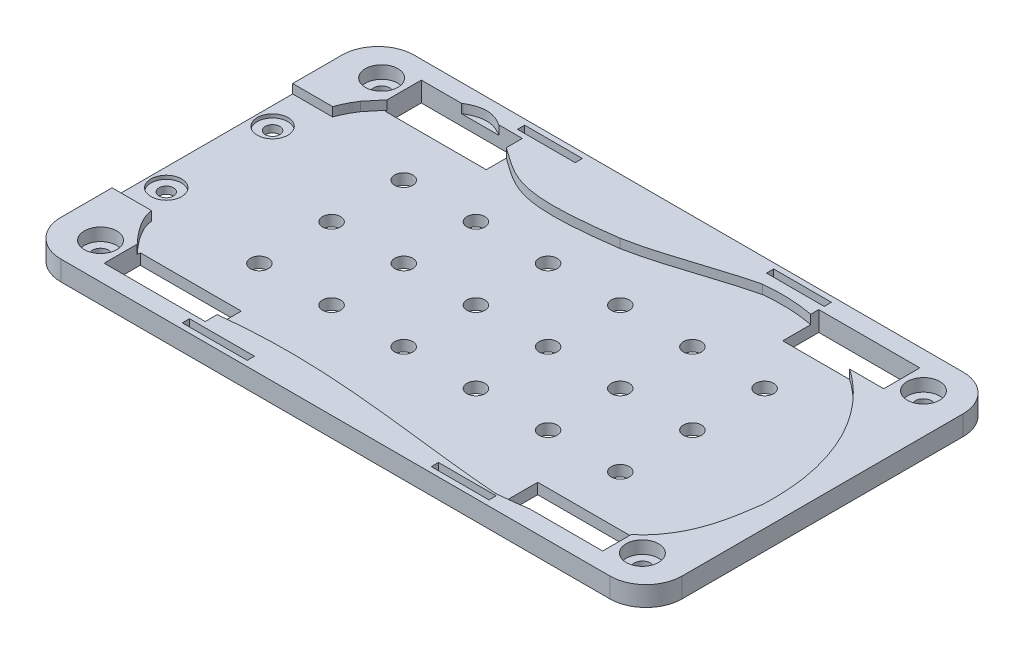
from build123d import *

# Parameters (mm, degrees)
BOSS_EXTRUDE2_DEPTH        = 6.5
CUT_EXTRUDE1_DEPTH         = 2.5
SKETCH7_W                  = 15.126318285
SKETCH7_H                  = 50.045217971
CUT_EXTRUDE2_DEPTH         = 2.5
SKETCH9_R                  = 4.5
CUT_EXTRUDE5_DEPTH         = 3.5
SKETCH10_R                 = 2.25
CUT_EXTRUDE6_DEPTH         = 21
SKETCH8_W                  = 28
SKETCH8_H                  = 10
CUT_EXTRUDE8_DEPTH         = 42
SKETCH8_3_W                = 12
SKETCH8_3_H                = 10
SKETCH8_3_R                = 3.5
CUT_EXTRUDE9_DEPTH         = 1
MIRROR2_COPY_1_SKETCH_R    = 4.5
MIRROR2_COPY_1_DEPTH       = 3.5
MIRROR2_COPY_2_SKETCH_R    = 2.25
MIRROR2_COPY_2_DEPTH       = 21
MIRROR2_COPY_3_SKETCH_W    = 28
MIRROR2_COPY_3_SKETCH_H    = 10
MIRROR2_COPY_3_DEPTH       = 42
MIRROR2_COPY_4_SKETCH_W    = 12
MIRROR2_COPY_4_SKETCH_H    = 10
MIRROR2_COPY_4_SKETCH_R    = 3.5
MIRROR2_COPY_4_DEPTH       = 1
SKETCH13_W                 = 122.138782423
SKETCH13_H                 = 57.881417702
CUT_EXTRUDE10_DEPTH        = 1
SKETCH14_R                 = 2.5
CUT_EXTRUDE11_DEPTH        = 57
SKETCH16_W                 = 16
SKETCH16_H                 = 2
SKETCH16_W_2               = 18
CUT_EXTRUDE12_DEPTH        = 57
SKETCH17_W                 = 198.020150231
SKETCH17_H                 = 122.239022266
CUT_EXTRUDE14_DEPTH        = 48.5
SKETCH23_R                 = 2
CUT_EXTRUDE15_DEPTH        = 48.5
SKETCH23_3_R               = 4.25
SKETCH23_3_R_2             = 2
CUT_EXTRUDE16_DEPTH        = 1
SKETCH24_R                 = 3.25
SKETCH24_R_2               = 2.25
BOSS_EXTRUDE3_DEPTH        = 1
MIRROR5_COPY_1_SKETCH_R    = 4.5
MIRROR5_COPY_1_DEPTH       = 3.5
MIRROR5_COPY_2_SKETCH_R    = 2.25
MIRROR5_COPY_2_DEPTH       = 21
MIRROR5_COPY_3_SKETCH_W    = 28
MIRROR5_COPY_3_SKETCH_H    = 10
MIRROR5_COPY_3_DEPTH       = 42
MIRROR5_COPY_4_SKETCH_W    = 12
MIRROR5_COPY_4_SKETCH_H    = 10
MIRROR5_COPY_4_SKETCH_R    = 3.5
MIRROR5_COPY_4_DEPTH       = 1
MIRROR5_COPY_5_SKETCH_R    = 4.5
MIRROR5_COPY_5_DEPTH       = 3.5
MIRROR5_COPY_6_SKETCH_R    = 2.25
MIRROR5_COPY_6_DEPTH       = 21
MIRROR5_COPY_7_SKETCH_W    = 28
MIRROR5_COPY_7_SKETCH_H    = 10
MIRROR5_COPY_7_DEPTH       = 42
MIRROR5_COPY_8_SKETCH_W    = 12
MIRROR5_COPY_8_SKETCH_H    = 10
MIRROR5_COPY_8_SKETCH_R    = 3.5
MIRROR5_COPY_8_DEPTH       = 1
MIRROR5_COPY_9_SKETCH_R    = 4.5
MIRROR5_COPY_9_DEPTH       = 3.5
MIRROR5_COPY_10_SKETCH_R   = 2.25
MIRROR5_COPY_10_DEPTH      = 21
MIRROR5_COPY_11_SKETCH_W   = 28
MIRROR5_COPY_11_SKETCH_H   = 10
MIRROR5_COPY_11_DEPTH      = 42
MIRROR5_COPY_12_SKETCH_W   = 12
MIRROR5_COPY_12_SKETCH_H   = 10
MIRROR5_COPY_12_SKETCH_R   = 3.5
MIRROR5_COPY_12_DEPTH      = 1
MIRROR5_COPY_13_SKETCH_R   = 2
MIRROR5_COPY_13_DEPTH      = 48.5
MIRROR5_COPY_14_SKETCH_R   = 4.25
MIRROR5_COPY_14_SKETCH_R_2 = 2
MIRROR5_COPY_14_DEPTH      = 1
CUT_EXTRUDE18_START        = -5.5
SKETCH25_W                 = 220.332555495
SKETCH25_H                 = 149.430085415
CUT_EXTRUDE18_DEPTH        = 6.5


with BuildPart() as part:
    # Sketch6 → Boss-Extrude2 (new body)
    with BuildSketch(Plane(origin=(0, 0, 0), x_dir=(1, 0, 0), z_dir=(0, 1, 0))):
        with BuildLine():
            Line((73.981646775, 59.583909473), (-78.157135648, 59.583909473))
            ThreePointArc((-78.157135648, 59.583909473), (-85.22820346, 56.654977285), (-88.157135648, 49.583909473))
            Line((-88.157135648, 49.583909473), (-88.157135648, -28.297508229))
            ThreePointArc((-88.157135648, -28.297508229), (-85.22820346, -35.368576041), (-78.157135648, -38.297508229))
            Line((-78.157135648, -38.297508229), (73.981646775, -38.297508229))
            ThreePointArc((73.981646775, -38.297508229), (81.052714587, -35.368576041), (83.981646775, -28.297508229))
            Line((83.981646775, -28.297508229), (83.981646775, 49.583909473))
            ThreePointArc((83.981646775, 49.583909473), (81.052714587, 56.654977285), (73.981646775, 59.583909473))
        make_face()
    boss_extrude2 = extrude(amount=BOSS_EXTRUDE2_DEPTH)

    # Sketch1 → Cut-Extrude1 (cut)
    with BuildSketch(Plane(origin=(0, 0, 0), x_dir=(1, 0, 0), z_dir=(0, 1, 0))):
        with BuildLine():
            Line((77.806365081, -0.96565382), (-77.157134057, -0.96565382))
            Line((-77.157134057, -0.96565382), (-77.157133487, -14.112200011))
            add(Edge.make_bspline(
                [(-77.157133487, -14.112200011), (-77.156536942, -14.370123486), (-77.109197781, -14.873209632), (-76.835922488, -15.955912897), (-76.187889009, -17.500769448), (-75.043983016, -19.418277882), (-73.152039277, -22.009216703), (-70.349522729, -25.082160357), (-66.873619377, -28.097169115), (-63.686430755, -30.214139025), (-61.001852204, -31.406236435), (-58.827378352, -31.848010778), (-57.571800044, -31.879365283), (-56.919048161, -31.916770504)],
                knots=[0.000484301, 0.000484301, 0.000484301, 0.000484301, 0.031521334, 0.062558366, 0.124632431, 0.186706496, 0.248780561, 0.37292869, 0.49707682, 0.62122495, 0.745373079, 0.869521209, 0.993669339, 0.993669339, 0.993669339, 0.993669339], degree=3))
            add(Edge.make_bspline(
                [(-56.919048161, -31.916770504), (-56.676855651, -31.887329504), (-56.202107187, -31.827411173), (-55.17909933, -31.687000892), (-53.829380758, -31.487736495), (-52.075898695, -31.218386946), (-49.57440565, -30.835368063), (-46.14645809, -30.337211074), (-41.582465958, -29.781294531), (-36.59758114, -29.326101352), (-29.427370913, -28.913030471), (-19.557102597, -28.846779859), (-6.483877393, -29.587535165), (5.244808229, -30.786505775), (15.023020088, -31.929485511), (22.521025078, -32.809036887), (30.153844065, -33.641998773), (35.340846207, -34.107490241), (37.926285135, -34.298975741)],
                knots=[0.000538145, 0.000538145, 0.000538145, 0.000538145, 0.016151963, 0.031765781, 0.062993416, 0.094221052, 0.125448688, 0.18790396, 0.250359232, 0.312814503, 0.375269775, 0.500180319, 0.625090862, 0.750001406, 0.812456678, 0.874911949, 0.937367221, 0.999822493, 0.999822493, 0.999822493, 0.999822493], degree=3))
            ThreePointArc((37.926285135, -34.298975741), (38.702526051, -34.294429262), (39.475271872, -34.220710033))
            add(Edge.make_bspline(
                [(39.475271872, -34.220710033), (41.007855914, -34.057436076), (44.089984585, -33.714701696), (50.083540013, -32.842915348), (57.096899249, -31.185924421), (64.218389099, -27.883874428), (69.776327895, -23.185685517), (73.049743993, -18.278857828), (74.917700916, -14.026885359), (75.980532113, -10.773207259), (76.750872111, -7.572378035), (77.199527425, -5.064024493), (77.479780782, -3.227934), (77.653952405, -2.012317888), (77.758523252, -1.282417326), (77.806365081, -0.96565382)],
                knots=[-0.000308659, -0.000308659, -0.000308659, -0.000308659, 0.063093373, 0.126495404, 0.253299468, 0.380103532, 0.506907596, 0.633711659, 0.697113691, 0.760515723, 0.823917755, 0.887319787, 0.919020803, 0.950721818, 0.978851886, 0.978851886, 0.978851886, 0.978851886], degree=3))
        make_face()
        with BuildLine():
            Line((-77.157135648, 35.76464303), (-77.157134057, -0.96565382))
            Line((-77.157134057, -0.96565382), (77.806365081, -0.96565382))
            add(Edge.make_bspline(
                [(77.806365081, -0.96565382), (77.812438323, -0.925442533), (77.87221605, -0.53245946), (77.930059012, -0.183407073), (77.984899751, 0.147711222)],
                knots=[0.978851886, 0.978851886, 0.978851886, 0.978851886, 0.982422834, 1.01412385, 1.01412385, 1.01412385, 1.01412385], degree=3))
            add(Edge.make_bspline(
                [(77.984899751, 0.147711222), (78.028632075, 1.263321996), (78.063685274, 3.522430751), (77.942610131, 6.756968322), (77.659550444, 9.90467033), (77.073307047, 13.967118446), (75.962568899, 18.783585703), (73.443316656, 25.935742417), (69.020568834, 33.80984715), (62.049489108, 41.493231365), (53.789484117, 47.344418041), (44.612113932, 51.294661515), (34.903628635, 53.280392725), (28.311253849, 53.235690332), (25.060177828, 52.873239487)],
                knots=[0.000169226, 0.000169226, 0.000169226, 0.000169226, 0.031413574, 0.062657922, 0.09390227, 0.125146618, 0.187635314, 0.25012401, 0.375101401, 0.500078793, 0.625056185, 0.750033577, 0.875010969, 0.999988361, 0.999988361, 0.999988361, 0.999988361], degree=3))
            add(Edge.make_bspline(
                [(25.060177828, 52.873239487), (19.895446944, 51.629390577), (12.322434608, 49.13169364), (2.160698602, 45.971278142), (-3.037110446, 44.691336857), (-5.659268145, 44.190364293)],
                knots=[0.000658959, 0.000658959, 0.000658959, 0.000658959, 0.498067368, 0.746771573, 0.995475778, 0.995475778, 0.995475778, 0.995475778], degree=3))
            add(Edge.make_bspline(
                [(-5.659268145, 44.190364293), (-6.687899132, 44.046149587), (-8.728734339, 43.771857825), (-12.963271971, 43.266800577), (-18.182613839, 42.795189919), (-23.901458121, 42.63215561), (-28.830638135, 42.989857068), (-32.966568973, 43.951399156), (-35.917714049, 45.291439085), (-38.19591431, 46.677930402), (-39.939161114, 47.865789175), (-41.506959745, 48.979842665), (-42.863802202, 49.929184347), (-43.616290768, 50.440510486), (-43.98532936, 50.688555671)],
                knots=[-0.00019559, -0.00019559, -0.00019559, -0.00019559, 0.062587211, 0.125370012, 0.250935613, 0.376501215, 0.502066816, 0.627632417, 0.753198019, 0.81598082, 0.87876362, 0.941546421, 0.972937821, 1.004329222, 1.004329222, 1.004329222, 1.004329222], degree=3))
            add(Edge.make_bspline(
                [(-43.98532936, 50.688555671), (-44.244485854, 50.867312015), (-44.768150418, 51.232519494), (-45.750657054, 51.933111662), (-46.891239492, 52.75905139), (-48.145972585, 53.649626958), (-49.697116091, 54.681113287), (-51.460780236, 55.648746777), (-53.407719169, 56.259273829), (-55.251731489, 56.357375065), (-56.710973324, 56.08081223), (-57.794758617, 55.713765742), (-58.546542767, 55.391458897), (-59.229896481, 55.042763399), (-59.583745645, 54.835934013), (-59.770155285, 54.723823826)],
                knots=[-0.002497219, -0.002497219, -0.002497219, -0.002497219, 0.029065652, 0.060628523, 0.123754265, 0.186880007, 0.250005749, 0.376257234, 0.502508718, 0.628760202, 0.755011687, 0.818137429, 0.881263171, 0.944388913, 1.007514655, 1.007514655, 1.007514655, 1.007514655], degree=3))
            add(Edge.make_bspline(
                [(-59.770155285, 54.723823826), (-60.193626174, 54.476092852), (-61.03864602, 53.961192652), (-62.636768194, 52.907176262), (-65.258656407, 50.976312285), (-68.51709364, 48.049765778), (-71.244275363, 45.065662035), (-73.189921829, 42.724657875), (-74.069794154, 41.617885903), (-74.515784144, 41.052117052)],
                knots=[0.000174078, 0.000174078, 0.000174078, 0.000174078, 0.062881444, 0.12558881, 0.251003541, 0.501833004, 0.752662466, 0.878077198, 1.003491929, 1.003491929, 1.003491929, 1.003491929], degree=3))
            add(Edge.make_bspline(
                [(-74.515784144, 41.052117052), (-75.065753244, 40.22169422), (-76.07645723, 38.477870595), (-76.833603448, 36.687528936), (-77.157135648, 35.76464303)],
                knots=[0.499549048, 0.499549048, 0.499549048, 0.499549048, 0.499765799, 0.49998255, 0.49998255, 0.49998255, 0.49998255], degree=3))
        make_face()
    cut_extrude1 = extrude(amount=CUT_EXTRUDE1_DEPTH, mode=Mode.SUBTRACT)

    # Sketch7 → Cut-Extrude2 (cut)
    with BuildSketch(Plane.XZ):
        with Locations((-83.782077592, -10.91040897)):
            Rectangle(SKETCH7_W, SKETCH7_H)
    cut_extrude2 = extrude(amount=-CUT_EXTRUDE2_DEPTH, mode=Mode.SUBTRACT)

    # Sketch9 → Cut-Extrude5 (cut)
    with BuildSketch(Plane.XZ):
        with Locations(Location((72.981646775, -49.583909473, 0), (0, 0, 270))):
            Circle(SKETCH9_R)
    cut_extrude5 = extrude(amount=-CUT_EXTRUDE5_DEPTH, mode=Mode.SUBTRACT)

    # Sketch10 → Cut-Extrude6 (cut)
    with BuildSketch(Plane.XZ.offset(-3.5)):
        with Locations(Location((72.981646775, -49.583909473, 0), (0, 0, 270))):
            Circle(SKETCH10_R)
    cut_extrude6 = extrude(amount=-CUT_EXTRUDE6_DEPTH, mode=Mode.SUBTRACT)

    # Sketch8 → Cut-Extrude8 (cut)
    with BuildSketch(Plane(origin=(0, 6.5, 0), x_dir=(1, 0, 0), z_dir=(0, 1, 0))):
        with Locations((52.981646775, 49.583909473)):
            Rectangle(SKETCH8_W, SKETCH8_H)
    cut_extrude8 = extrude(amount=-CUT_EXTRUDE8_DEPTH, mode=Mode.SUBTRACT)

    # Sketch8<3> → Cut-Extrude9 (cut)
    with BuildSketch(Plane(origin=(0, 6.5, 0), x_dir=(1, 0, 0), z_dir=(0, 1, 0))):
        with Locations((72.981646775, 49.583909473)):
            Rectangle(SKETCH8_3_W, SKETCH8_3_H)
        with Locations(Location((72.981646775, 49.583909473, 0), (0, 0, 270))):
            Circle(SKETCH8_3_R, mode=Mode.SUBTRACT)
    cut_extrude9 = extrude(amount=-CUT_EXTRUDE9_DEPTH, mode=Mode.SUBTRACT)

    # Mirror1: Cut-Extrude5, Cut-Extrude6, Cut-Extrude8, Cut-Extrude9 across plane
    add(cut_extrude5.mirror(Plane.XY.offset(-10.643200622)), mode=Mode.SUBTRACT)
    add(cut_extrude6.mirror(Plane.XY.offset(-10.643200622)), mode=Mode.SUBTRACT)
    add(cut_extrude8.mirror(Plane.XY.offset(-10.643200622)), mode=Mode.SUBTRACT)
    add(cut_extrude9.mirror(Plane.XY.offset(-10.643200622)), mode=Mode.SUBTRACT)

    # Mirror2: Cut-Extrude5, Cut-Extrude6, Cut-Extrude8, Cut-Extrude9 across plane
    add(cut_extrude5.mirror(Plane.ZY.offset(2.087744437)), mode=Mode.SUBTRACT)
    add(cut_extrude6.mirror(Plane.ZY.offset(2.087744437)), mode=Mode.SUBTRACT)
    add(cut_extrude8.mirror(Plane.ZY.offset(2.087744437)), mode=Mode.SUBTRACT)
    add(cut_extrude9.mirror(Plane.ZY.offset(2.087744437)), mode=Mode.SUBTRACT)

    # Mirror2 copy 1 sketch → Mirror2 copy 1 (cut)
    with BuildSketch(Plane(origin=(-4.175488873, 0, -21.286401244), x_dir=(-1, 0, 0), z_dir=(0, -1, 0))):
        with Locations(Location((72.981646775, -49.583909473, 0), (0, 0, 270))):
            Circle(MIRROR2_COPY_1_SKETCH_R)
    extrude(amount=-MIRROR2_COPY_1_DEPTH, mode=Mode.SUBTRACT)

    # Mirror2 copy 2 sketch → Mirror2 copy 2 (cut)
    with BuildSketch(Plane(origin=(-4.175488873, 3.5, -21.286401244), x_dir=(-1, 0, 0), z_dir=(0, -1, 0))):
        with Locations(Location((72.981646775, -49.583909473, 0), (0, 0, 270))):
            Circle(MIRROR2_COPY_2_SKETCH_R)
    extrude(amount=-MIRROR2_COPY_2_DEPTH, mode=Mode.SUBTRACT)

    # Mirror2 copy 3 sketch → Mirror2 copy 3 (cut)
    with BuildSketch(Plane(origin=(-4.175488873, 6.5, -21.286401244), x_dir=(-1, 0, 0), z_dir=(0, 1, 0))):
        with Locations((52.981646775, 49.583909473)):
            Rectangle(MIRROR2_COPY_3_SKETCH_W, MIRROR2_COPY_3_SKETCH_H)
    extrude(amount=-MIRROR2_COPY_3_DEPTH, mode=Mode.SUBTRACT)

    # Mirror2 copy 4 sketch → Mirror2 copy 4 (cut)
    with BuildSketch(Plane(origin=(-4.175488873, 6.5, -21.286401244), x_dir=(-1, 0, 0), z_dir=(0, 1, 0))):
        with Locations((72.981646775, 49.583909473)):
            Rectangle(MIRROR2_COPY_4_SKETCH_W, MIRROR2_COPY_4_SKETCH_H)
        with Locations(Location((72.981646775, 49.583909473, 0), (0, 0, 270))):
            Circle(MIRROR2_COPY_4_SKETCH_R, mode=Mode.SUBTRACT)
    extrude(amount=-MIRROR2_COPY_4_DEPTH, mode=Mode.SUBTRACT)

    # Sketch13 → Cut-Extrude10 (cut)
    with BuildSketch(Plane(origin=(0, 6.5, 0), x_dir=(1, 0, 0), z_dir=(0, 1, 0))):
        with Locations((-2.087744436, 10.643200622)):
            Rectangle(SKETCH13_W, SKETCH13_H)
    cut_extrude10 = extrude(amount=-CUT_EXTRUDE10_DEPTH, mode=Mode.SUBTRACT)

    # Sketch14 → Cut-Extrude11 (cut)
    with BuildSketch(Plane(origin=(0, 5.5, 0), x_dir=(1, 0, 0), z_dir=(0, 1, 0))):
        with Locations(Location((-52.087744437, 30.643200622, 0), (0, 0, 270))):
            Circle(SKETCH14_R)
        with Locations(Location((7.912255563, 30.643200622, 0), (0, 0, 270))):
            Circle(SKETCH14_R)
        with Locations(Location((27.912255563, 30.643200622, 0), (0, 0, 270))):
            Circle(SKETCH14_R)
        with Locations(Location((47.912255563, 30.643200622, 0), (0, 0, 270))):
            Circle(SKETCH14_R)
        with Locations(Location((47.912255563, 10.643200622, 0), (0, 0, 270))):
            Circle(SKETCH14_R)
        with Locations(Location((7.912255563, 10.643200622, 0), (0, 0, 270))):
            Circle(SKETCH14_R)
        with Locations(Location((-12.087744437, 10.643200622, 0), (0, 0, 270))):
            Circle(SKETCH14_R)
        with Locations(Location((-32.087744437, 10.643200622, 0), (0, 0, 270))):
            Circle(SKETCH14_R)
        with Locations(Location((-52.087744437, 10.643200622, 0), (0, 0, 270))):
            Circle(SKETCH14_R)
        with Locations(Location((47.912255563, -9.356799378, 0), (0, 0, 270))):
            Circle(SKETCH14_R)
        with Locations(Location((27.912255563, -9.356799378, 0), (0, 0, 270))):
            Circle(SKETCH14_R)
        with Locations(Location((7.912255563, -9.356799378, 0), (0, 0, 270))):
            Circle(SKETCH14_R)
        with Locations(Location((-12.087744437, -9.356799378, 0), (0, 0, 270))):
            Circle(SKETCH14_R)
        with Locations(Location((-32.087744437, -9.356799378, 0), (0, 0, 270))):
            Circle(SKETCH14_R)
        with Locations(Location((-52.087744437, -9.356799378, 0), (0, 0, 270))):
            Circle(SKETCH14_R)
        with Locations(Location((-32.087744437, 30.643200622, 0), (0, 0, 270))):
            Circle(SKETCH14_R)
        with Locations(Location((-12.087744437, 30.643200622, 0), (0, 0, 270))):
            Circle(SKETCH14_R)
        with Locations(Location((27.912255563, 10.643200622, 0), (0, 0, 270))):
            Circle(SKETCH14_R)
    cut_extrude11 = extrude(amount=-CUT_EXTRUDE11_DEPTH, mode=Mode.SUBTRACT)

    # Sketch16 → Cut-Extrude12 (cut)
    with BuildSketch(Plane.XZ):
        with Locations((30.981646775, -57.083909473)):
            Rectangle(SKETCH16_W, SKETCH16_H)
        with Locations((30.981646775, 35.797508229)):
            Rectangle(SKETCH16_W, SKETCH16_H)
        with Locations((-38.018353225, -57.083909473)):
            Rectangle(SKETCH16_W, SKETCH16_H)
        with Locations((-37.018353225, 35.797508229)):
            Rectangle(SKETCH16_W_2, SKETCH16_H)
    cut_extrude12 = extrude(amount=-CUT_EXTRUDE12_DEPTH, mode=Mode.SUBTRACT)

    # Sketch17 → Cut-Extrude14 (cut)
    with BuildSketch(Plane(origin=(0, 5.5, 0), x_dir=(1, 0, 0), z_dir=(0, 1, 0))):
        with Locations((-0.586253557, 7.90518784)):
            Rectangle(SKETCH17_W, SKETCH17_H)
    cut_extrude14 = extrude(amount=CUT_EXTRUDE14_DEPTH, mode=Mode.SUBTRACT)

    # Sketch23 → Cut-Extrude15 (cut)
    with BuildSketch(Plane.XZ.offset(-2.5)):
        with Locations(Location((-83.157135648, 4.08959103, 0), (0, 0, 270))):
            Circle(SKETCH23_R)
    cut_extrude15 = extrude(amount=-CUT_EXTRUDE15_DEPTH, mode=Mode.SUBTRACT)

    # Sketch23<3> → Cut-Extrude16 (cut)
    with BuildSketch(Plane.XZ.offset(-2.5)):
        with Locations(Location((-83.157135648, 4.08959103, 0), (0, 0, 270))):
            Circle(SKETCH23_3_R)
        with Locations(Location((-83.157135648, 4.08959103, 0), (0, 0, 270))):
            Circle(SKETCH23_3_R_2, mode=Mode.SUBTRACT)
    cut_extrude16 = extrude(amount=-CUT_EXTRUDE16_DEPTH, mode=Mode.SUBTRACT)

    # Mirror4: Cut-Extrude15, Cut-Extrude16 across plane
    add(cut_extrude15.mirror(Plane.XY.offset(-10.643200622)), mode=Mode.SUBTRACT)
    add(cut_extrude16.mirror(Plane.XY.offset(-10.643200622)), mode=Mode.SUBTRACT)

    # Sketch24 → Boss-Extrude3 (add)
    # profile 1 of 4: a face of its own
    with BuildSketch(Plane(origin=(0, 5.5, 0), x_dir=(1, 0, 0), z_dir=(0, 1, 0))):
        with Locations(Location((-77.157135648, 49.583909473, 0), (0, 0, 270))):
            Circle(SKETCH24_R)
        with Locations(Location((-77.157135648, 49.583909473, 0), (0, 0, 90))):
            Circle(SKETCH24_R_2, mode=Mode.SUBTRACT)
    # profile 2 of 4: a face of its own
    with BuildSketch(Plane(origin=(0, 5.5, 0), x_dir=(1, 0, 0), z_dir=(0, 1, 0))):
        with Locations(Location((72.981646775, 49.583909473, 0), (0, 0, 270))):
            Circle(SKETCH24_R)
        with Locations(Location((72.981646775, 49.583909473, 0), (0, 0, 90))):
            Circle(SKETCH24_R_2, mode=Mode.SUBTRACT)
    # profile 3 of 4: a face of its own
    with BuildSketch(Plane(origin=(0, 5.5, 0), x_dir=(1, 0, 0), z_dir=(0, 1, 0))):
        with Locations(Location((-77.157135648, -28.297508229, 0), (0, 0, 270))):
            Circle(SKETCH24_R)
        with Locations(Location((-77.157135648, -28.297508229, 0), (0, 0, 270))):
            Circle(SKETCH24_R_2, mode=Mode.SUBTRACT)
    # profile 4 of 4: a face of its own
    with BuildSketch(Plane(origin=(0, 5.5, 0), x_dir=(1, 0, 0), z_dir=(0, 1, 0))):
        with Locations(Location((72.981646775, -28.297508229, 0), (0, 0, 270))):
            Circle(SKETCH24_R)
        with Locations(Location((72.981646775, -28.297508229, 0), (0, 0, 270))):
            Circle(SKETCH24_R_2, mode=Mode.SUBTRACT)
    boss_extrude3 = extrude(amount=BOSS_EXTRUDE3_DEPTH)

    # Mirror5: Boss-Extrude2, Cut-Extrude1, Cut-Extrude2, Cut-Extrude5, Cut-Extrude6, Cut-Extrude8, Cut-Extrude9, Cut-Extrude10, Cut-Extrude11, Cut-Extrude12, Cut-Extrude14, Cut-Extrude15, Cut-Extrude16, Boss-Extrude3 across plane
    add(boss_extrude2.mirror(Plane(origin=(0, 0, 0), x_dir=(0, 0, 1), z_dir=(0, -1, 0))))
    add(cut_extrude1.mirror(Plane(origin=(0, 0, 0), x_dir=(0, 0, 1), z_dir=(0, -1, 0))), mode=Mode.SUBTRACT)
    add(cut_extrude2.mirror(Plane(origin=(0, 0, 0), x_dir=(0, 0, 1), z_dir=(0, -1, 0))), mode=Mode.SUBTRACT)
    add(cut_extrude5.mirror(Plane(origin=(0, 0, 0), x_dir=(0, 0, 1), z_dir=(0, -1, 0))), mode=Mode.SUBTRACT)
    add(cut_extrude6.mirror(Plane(origin=(0, 0, 0), x_dir=(0, 0, 1), z_dir=(0, -1, 0))), mode=Mode.SUBTRACT)
    add(cut_extrude8.mirror(Plane(origin=(0, 0, 0), x_dir=(0, 0, 1), z_dir=(0, -1, 0))), mode=Mode.SUBTRACT)
    add(cut_extrude9.mirror(Plane(origin=(0, 0, 0), x_dir=(0, 0, 1), z_dir=(0, -1, 0))), mode=Mode.SUBTRACT)
    add(cut_extrude10.mirror(Plane(origin=(0, 0, 0), x_dir=(0, 0, 1), z_dir=(0, -1, 0))), mode=Mode.SUBTRACT)
    add(cut_extrude11.mirror(Plane(origin=(0, 0, 0), x_dir=(0, 0, 1), z_dir=(0, -1, 0))), mode=Mode.SUBTRACT)
    add(cut_extrude12.mirror(Plane(origin=(0, 0, 0), x_dir=(0, 0, 1), z_dir=(0, -1, 0))), mode=Mode.SUBTRACT)
    add(cut_extrude14.mirror(Plane(origin=(0, 0, 0), x_dir=(0, 0, 1), z_dir=(0, -1, 0))), mode=Mode.SUBTRACT)
    add(cut_extrude15.mirror(Plane(origin=(0, 0, 0), x_dir=(0, 0, 1), z_dir=(0, -1, 0))), mode=Mode.SUBTRACT)
    add(cut_extrude16.mirror(Plane(origin=(0, 0, 0), x_dir=(0, 0, 1), z_dir=(0, -1, 0))), mode=Mode.SUBTRACT)
    add(boss_extrude3.mirror(Plane(origin=(0, 0, 0), x_dir=(0, 0, 1), z_dir=(0, -1, 0))))

    # Mirror5 copy 1 sketch → Mirror5 copy 1 (cut)
    with BuildSketch(Plane(origin=(0, 0, -21.286401244), x_dir=(1, 0, 0), z_dir=(0, 1, 0))):
        with Locations(Location((72.981646775, -49.583909473, 0), (0, 0, 270))):
            Circle(MIRROR5_COPY_1_SKETCH_R)
    extrude(amount=-MIRROR5_COPY_1_DEPTH, mode=Mode.SUBTRACT)

    # Mirror5 copy 2 sketch → Mirror5 copy 2 (cut)
    with BuildSketch(Plane(origin=(0, -3.5, -21.286401244), x_dir=(1, 0, 0), z_dir=(0, 1, 0))):
        with Locations(Location((72.981646775, -49.583909473, 0), (0, 0, 270))):
            Circle(MIRROR5_COPY_2_SKETCH_R)
    extrude(amount=-MIRROR5_COPY_2_DEPTH, mode=Mode.SUBTRACT)

    # Mirror5 copy 3 sketch → Mirror5 copy 3 (cut)
    with BuildSketch(Plane(origin=(0, -6.5, -21.286401244), x_dir=(1, 0, 0), z_dir=(0, -1, 0))):
        with Locations((52.981646775, 49.583909473)):
            Rectangle(MIRROR5_COPY_3_SKETCH_W, MIRROR5_COPY_3_SKETCH_H)
    extrude(amount=-MIRROR5_COPY_3_DEPTH, mode=Mode.SUBTRACT)

    # Mirror5 copy 4 sketch → Mirror5 copy 4 (cut)
    with BuildSketch(Plane(origin=(0, -6.5, -21.286401244), x_dir=(1, 0, 0), z_dir=(0, -1, 0))):
        with Locations((72.981646775, 49.583909473)):
            Rectangle(MIRROR5_COPY_4_SKETCH_W, MIRROR5_COPY_4_SKETCH_H)
        with Locations(Location((72.981646775, 49.583909473, 0), (0, 0, 270))):
            Circle(MIRROR5_COPY_4_SKETCH_R, mode=Mode.SUBTRACT)
    extrude(amount=-MIRROR5_COPY_4_DEPTH, mode=Mode.SUBTRACT)

    # Mirror5 copy 5 sketch → Mirror5 copy 5 (cut)
    with BuildSketch(Plane(origin=(-4.175488873, 0, 0), x_dir=(-1, 0, 0), z_dir=(0, 1, 0))):
        with Locations(Location((72.981646775, -49.583909473, 0), (0, 0, 270))):
            Circle(MIRROR5_COPY_5_SKETCH_R)
    extrude(amount=-MIRROR5_COPY_5_DEPTH, mode=Mode.SUBTRACT)

    # Mirror5 copy 6 sketch → Mirror5 copy 6 (cut)
    with BuildSketch(Plane(origin=(-4.175488873, -3.5, 0), x_dir=(-1, 0, 0), z_dir=(0, 1, 0))):
        with Locations(Location((72.981646775, -49.583909473, 0), (0, 0, 270))):
            Circle(MIRROR5_COPY_6_SKETCH_R)
    extrude(amount=-MIRROR5_COPY_6_DEPTH, mode=Mode.SUBTRACT)

    # Mirror5 copy 7 sketch → Mirror5 copy 7 (cut)
    with BuildSketch(Plane(origin=(-4.175488873, -6.5, 0), x_dir=(-1, 0, 0), z_dir=(0, -1, 0))):
        with Locations((52.981646775, 49.583909473)):
            Rectangle(MIRROR5_COPY_7_SKETCH_W, MIRROR5_COPY_7_SKETCH_H)
    extrude(amount=-MIRROR5_COPY_7_DEPTH, mode=Mode.SUBTRACT)

    # Mirror5 copy 8 sketch → Mirror5 copy 8 (cut)
    with BuildSketch(Plane(origin=(-4.175488873, -6.5, 0), x_dir=(-1, 0, 0), z_dir=(0, -1, 0))):
        with Locations((72.981646775, 49.583909473)):
            Rectangle(MIRROR5_COPY_8_SKETCH_W, MIRROR5_COPY_8_SKETCH_H)
        with Locations(Location((72.981646775, 49.583909473, 0), (0, 0, 270))):
            Circle(MIRROR5_COPY_8_SKETCH_R, mode=Mode.SUBTRACT)
    extrude(amount=-MIRROR5_COPY_8_DEPTH, mode=Mode.SUBTRACT)

    # Mirror5 copy 9 sketch → Mirror5 copy 9 (cut)
    with BuildSketch(Plane(origin=(-4.175488873, 0, -21.286401244), x_dir=(-1, 0, 0), z_dir=(0, 1, 0))):
        with Locations((72.981646775, 49.583909473)):
            Circle(MIRROR5_COPY_9_SKETCH_R)
    extrude(amount=-MIRROR5_COPY_9_DEPTH, mode=Mode.SUBTRACT)

    # Mirror5 copy 10 sketch → Mirror5 copy 10 (cut)
    with BuildSketch(Plane(origin=(-4.175488873, -3.5, -21.286401244), x_dir=(-1, 0, 0), z_dir=(0, 1, 0))):
        with Locations((72.981646775, 49.583909473)):
            Circle(MIRROR5_COPY_10_SKETCH_R)
    extrude(amount=-MIRROR5_COPY_10_DEPTH, mode=Mode.SUBTRACT)

    # Mirror5 copy 11 sketch → Mirror5 copy 11 (cut)
    with BuildSketch(Plane(origin=(-4.175488873, -6.5, -21.286401244), x_dir=(-1, 0, 0), z_dir=(0, -1, 0))):
        with Locations((52.981646775, -49.583909473)):
            Rectangle(MIRROR5_COPY_11_SKETCH_W, MIRROR5_COPY_11_SKETCH_H)
    extrude(amount=-MIRROR5_COPY_11_DEPTH, mode=Mode.SUBTRACT)

    # Mirror5 copy 12 sketch → Mirror5 copy 12 (cut)
    with BuildSketch(Plane(origin=(-4.175488873, -6.5, -21.286401244), x_dir=(-1, 0, 0), z_dir=(0, -1, 0))):
        with Locations((72.981646775, -49.583909473)):
            Rectangle(MIRROR5_COPY_12_SKETCH_W, MIRROR5_COPY_12_SKETCH_H)
        with Locations((72.981646775, -49.583909473)):
            Circle(MIRROR5_COPY_12_SKETCH_R, mode=Mode.SUBTRACT)
    extrude(amount=-MIRROR5_COPY_12_DEPTH, mode=Mode.SUBTRACT)

    # Mirror5 copy 13 sketch → Mirror5 copy 13 (cut)
    with BuildSketch(Plane(origin=(0, -2.5, -21.286401244), x_dir=(1, 0, 0), z_dir=(0, 1, 0))):
        with Locations(Location((-83.157135648, 4.08959103, 0), (0, 0, 270))):
            Circle(MIRROR5_COPY_13_SKETCH_R)
    extrude(amount=-MIRROR5_COPY_13_DEPTH, mode=Mode.SUBTRACT)

    # Mirror5 copy 14 sketch → Mirror5 copy 14 (cut)
    with BuildSketch(Plane(origin=(0, -2.5, -21.286401244), x_dir=(1, 0, 0), z_dir=(0, 1, 0))):
        with Locations(Location((-83.157135648, 4.08959103, 0), (0, 0, 270))):
            Circle(MIRROR5_COPY_14_SKETCH_R)
        with Locations(Location((-83.157135648, 4.08959103, 0), (0, 0, 270))):
            Circle(MIRROR5_COPY_14_SKETCH_R_2, mode=Mode.SUBTRACT)
    extrude(amount=-MIRROR5_COPY_14_DEPTH, mode=Mode.SUBTRACT)

    # Sketch25 → Cut-Extrude18 (cut)
    with BuildSketch(Plane(origin=(0, 5.5, 0), x_dir=(1, 0, 0), z_dir=(0, 1, 0)).offset(CUT_EXTRUDE18_START)):
        with Locations((0.879197772, -1.00848127)):
            Rectangle(SKETCH25_W, SKETCH25_H)
    extrude(amount=CUT_EXTRUDE18_DEPTH, mode=Mode.SUBTRACT)


solid = part.part
